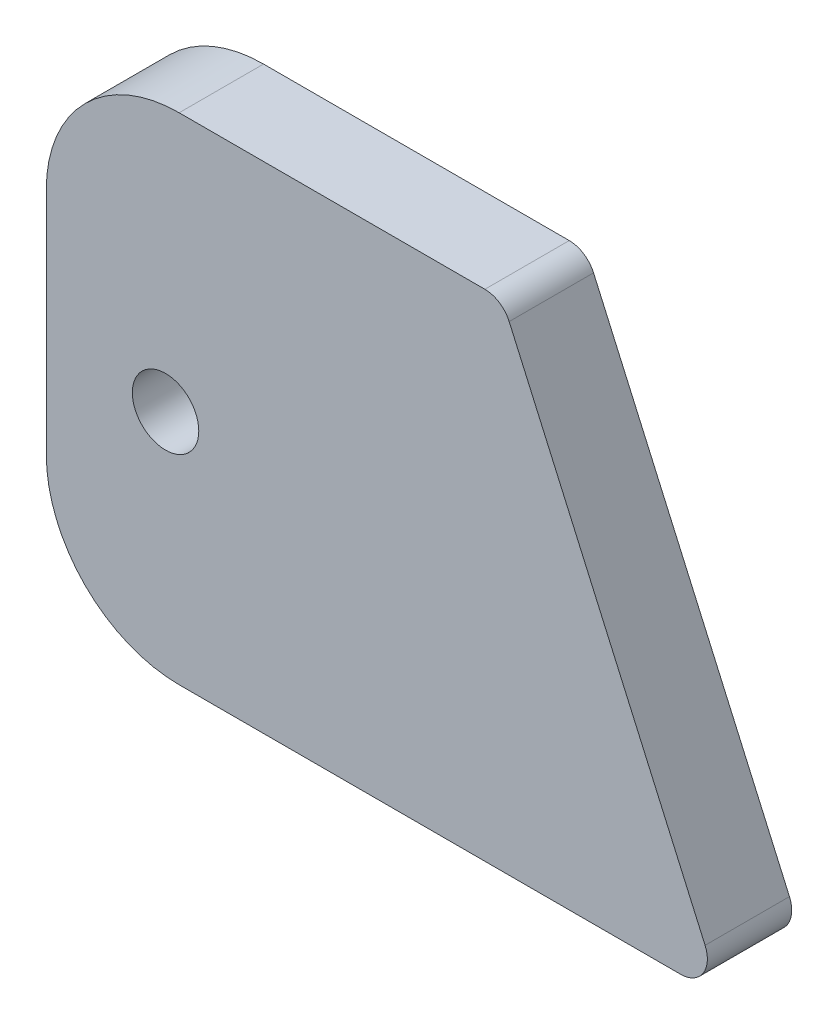
from build123d import *

# Parameters (mm, degrees)
BOSS_EXTRUDE1_DEPTH = 1.5875
FILLET1_R           = 1
FILLET2_R           = 5
SKETCH2_R           = 1.25
CUT_EXTRUDE1_DEPTH  = 17.357137005


with BuildPart() as part:
    # Sketch1 → Boss-Extrude1 (new, symmetric)
    with BuildSketch(Plane.XY):
        Polygon((-11.81540086, 9.32089354), (-11.81540086, -9.32089354), (12.941517766, -9.32089354), (13.597976447, -9.32089354), (5.339733299, 9.32089354), (4.683274618, 9.32089354), align=None)
    extrude(amount=BOSS_EXTRUDE1_DEPTH, both=True)

    # Fillet1
    fillet1_edges = [part.edges().sort_by_distance(p)[0] for p in [
        (5.339733299, 9.32089354, 0),
        (13.597976447, -9.32089354, 0),
    ]]
    fillet(fillet1_edges, radius=FILLET1_R)

    # Fillet2
    fillet2_edges = [part.edges().sort_by_distance(p)[0] for p in [
        (-11.81540086, -9.32089354, 0),
        (-11.81540086, 9.32089354, 0),
    ]]
    fillet(fillet2_edges, radius=FILLET2_R)

    # Sketch2 → Cut-Extrude1 (cut, through all)
    with BuildSketch(Plane.XY.offset(1.5875)):
        with Locations((-7.3274835, -0.67910646)):
            Circle(SKETCH2_R)
    extrude(amount=-CUT_EXTRUDE1_DEPTH, mode=Mode.SUBTRACT)


solid = part.part
